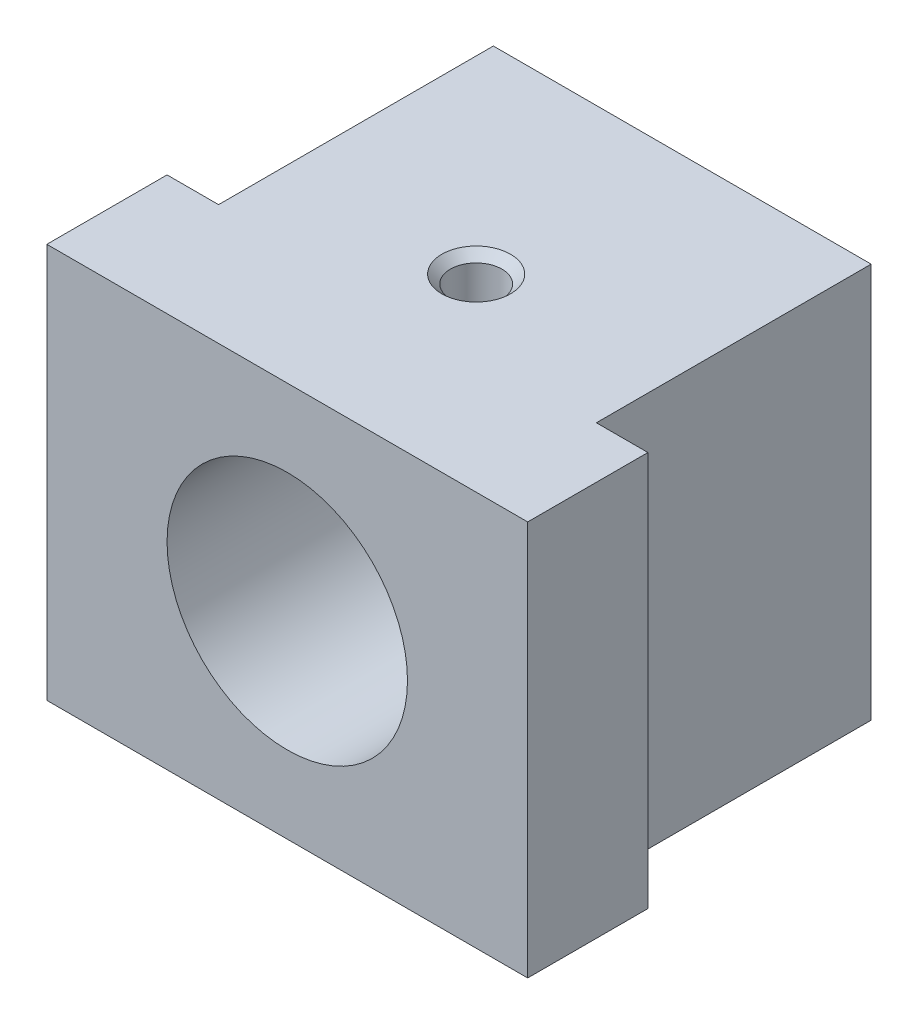
from build123d import *

# Parameters (mm, degrees)
BOSS_EXTRUDE1_DEPTH = 23
SKETCH2_R           = 7
CUT_EXTRUDE1_DEPTH  = 43.918527468
SKETCH3_R           = 1.5
CUT_EXTRUDE2_DEPTH  = 10
CHAMFER1_SIZE       = 0.5


with BuildPart() as part:
    # Sketch1 → Boss-Extrude1 (new body)
    with BuildSketch(Plane(origin=(0, 0, 0), x_dir=(1, 0, 0), z_dir=(0, 1, 0))):
        Polygon((0, 0), (28, 0), (28, 7), (25, 7), (25, 23), (3, 23), (3, 7), (0, 7), align=None)
    extrude(amount=BOSS_EXTRUDE1_DEPTH)

    # Sketch2 → Cut-Extrude1 (cut, through all)
    with BuildSketch(Plane.XY):
        with Locations((14, 11.5)):
            Circle(SKETCH2_R)
    extrude(amount=-CUT_EXTRUDE1_DEPTH, mode=Mode.SUBTRACT)

    # Sketch3 → Cut-Extrude2 (cut)
    with BuildSketch(Plane(origin=(0, 23, 0), x_dir=(1, 0, 0), z_dir=(0, 1, 0))):
        with Locations(Location((14, 11, 0), (0, 0, 270))):
            Circle(SKETCH3_R)
    extrude(amount=-CUT_EXTRUDE2_DEPTH, mode=Mode.SUBTRACT)

    # Chamfer1
    chamfer1_edges = [part.edges().sort_by_distance(p)[0] for p in [
        (14, 23, -12.5),
    ]]
    chamfer(chamfer1_edges, length=CHAMFER1_SIZE)


solid = part.part
